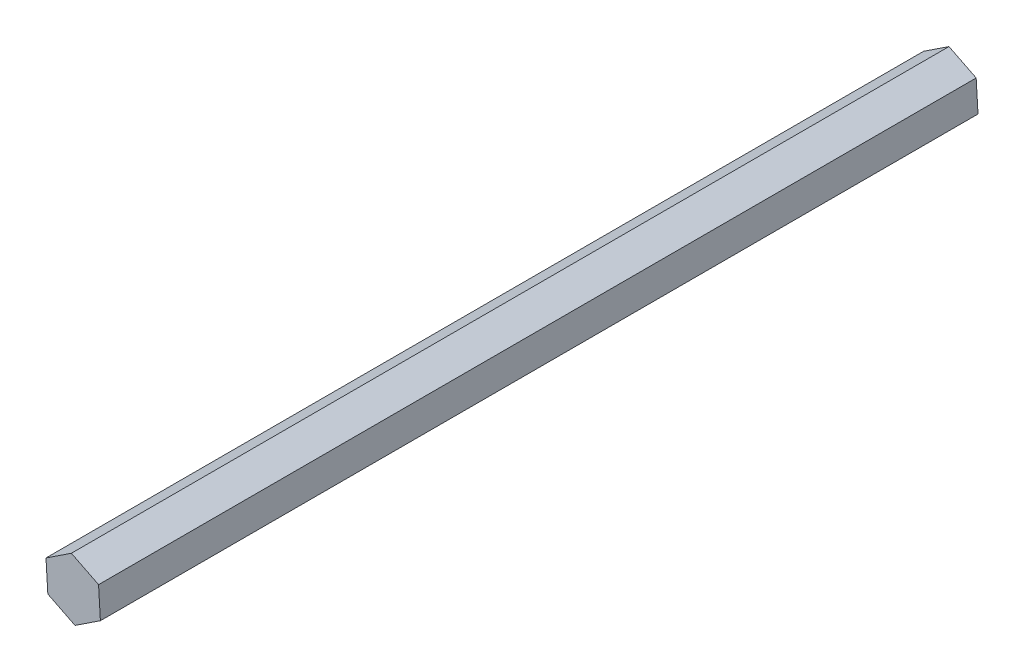
from build123d import *

# Parameters (mm, degrees)
BOSS_EXTRUDE1_DEPTH = 158.75


with BuildPart() as part:
    # Sketch1 → Boss-Extrude1 (new body)
    with BuildSketch(Plane(origin=(0, 0, 0), x_dir=(-1, 0, 0), z_dir=(0, 0, -1))):
        Polygon((4.91868885, 2.459344425), (0.329489676, 5.48938171), (-4.589199173, 3.030037285), (-4.91868885, -2.459344425), (-0.329489676, -5.48938171), (4.589199173, -3.030037285), align=None)
    extrude(amount=-BOSS_EXTRUDE1_DEPTH)


solid = part.part
